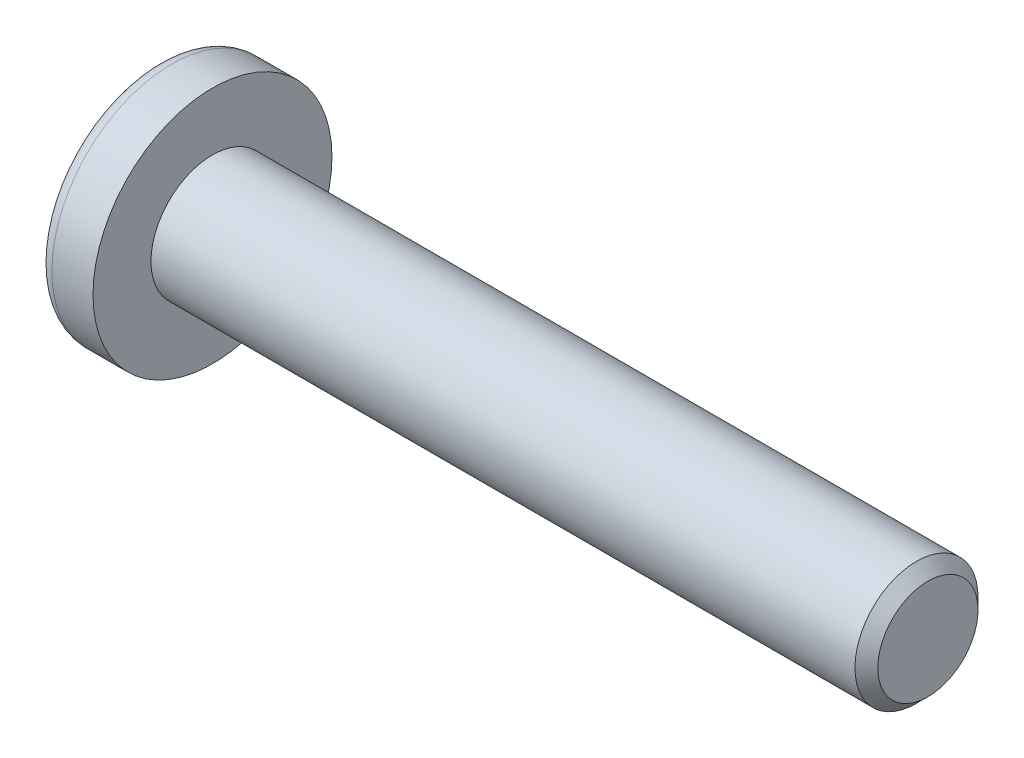
from build123d import *

# Parameters (mm, degrees)
CIRPATTERN1_COUNT = 2
CIRPATTERN1_ANGLE = 90
CHAMFER1_SIZE     = 0.2032


with BuildPart() as part:
    # BodySke → Base-Revolve (revolve)
    with BuildSketch(Plane.XY, mode=Mode.PRIVATE) as base_revolve_sk:
        with BuildLine():
            Line((1.5748, 1.0922), (1.5748, 2.1209))
            Line((1.5748, 2.1209), (0.845695803, 2.1209))
            ThreePointArc((0.845695803, 2.1209), (0.728748015, 2.09237553), (0.638066948, 2.013208777))
            ThreePointArc((0.638066948, 2.013208777), (0.163333253, 1.05595206), (0, 0))
            Line((0, 0), (14.2748, 0))
            Line((14.2748, 0), (14.2748, 1.0922))
            Line((14.2748, 1.0922), (1.5748, 1.0922))
        make_face()
    revolve(base_revolve_sk.sketch.rotate(Axis((-25.4, 0, 0), (1, 0, 0)), 90), axis=Axis((-25.4, 0, 0), (1, 0, 0)))

    # Sketch3 → Cut-Loft1 section 0
    with BuildSketch(Plane(origin=(0, 0, 0), x_dir=(0, 0, -1), z_dir=(1, 0, 0))):
        with BuildLine():
            Line((0.3429, -1.3843), (-0.3429, -1.3843))
            Line((-0.3429, -1.3843), (-0.3429, 1.3843))
            Line((-0.3429, 1.3843), (0.3429, 1.3843))
            Line((0.3429, 1.3843), (0.3429, -1.3843))
        make_face()
    # Sketch4 → Cut-Loft1 section 1
    with BuildSketch(Plane(origin=(1.4986, 0, 0), x_dir=(0, 0, -1), z_dir=(1, 0, 0))):
        with BuildLine():
            Line((0.17145, -0.17145), (-0.17145, -0.17145))
            Line((-0.17145, -0.17145), (-0.17145, 0.17145))
            Line((-0.17145, 0.17145), (0.17145, 0.17145))
            Line((0.17145, 0.17145), (0.17145, -0.17145))
        make_face()
    cut_loft1 = loft(mode=Mode.SUBTRACT)

    # CirPattern1: Cut-Loft1 ×2 about axis
    cirpattern1_axis = Axis((0, 0, 0), (1, 0, 0))
    for i in range(1, CIRPATTERN1_COUNT):
        add(cut_loft1.rotate(cirpattern1_axis, i * CIRPATTERN1_ANGLE / (CIRPATTERN1_COUNT - 1)), mode=Mode.SUBTRACT)

    # Chamfer1
    chamfer1_edges = [part.edges().sort_by_distance(p)[0] for p in [
        (14.2748, 0, -1.0922),
    ]]
    chamfer(chamfer1_edges, length=CHAMFER1_SIZE)


solid = part.part
